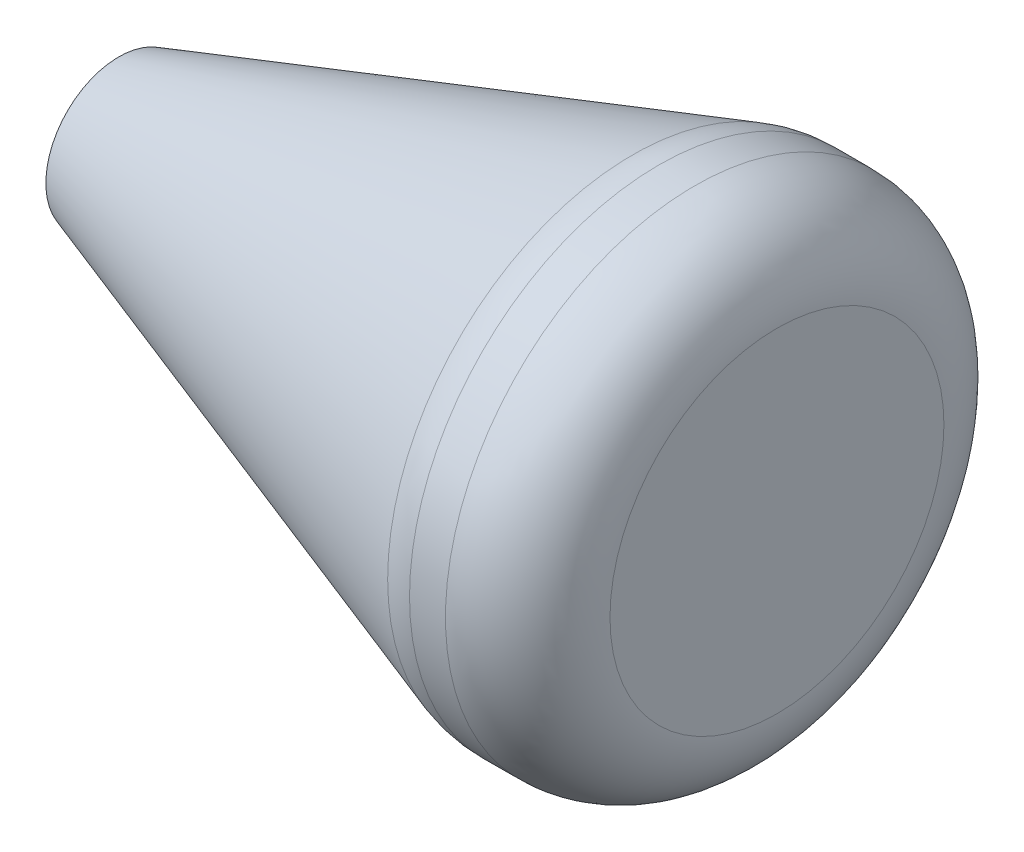
from build123d import *

# Parameters (mm, degrees)
FILLET1_R = 5
FILLET2_R = 5


with BuildPart() as part:
    # Sketch1 → Revolve1 (revolve)
    with BuildSketch(Plane(origin=(0, 0, 0), x_dir=(0, 1, 0), z_dir=(0, 0, 1)), mode=Mode.PRIVATE) as revolve1_sk:
        Polygon((0, 0), (0, 6), (2.8, 6), (2.8, 40), (4.437898451, 40), (15.149054344, 8), (15.149054344, 0), align=None)
    revolve(revolve1_sk.sketch.rotate(Axis((0, 0, 0), (-1, 0, 0)), 90), axis=Axis((0, 0, 0), (-1, 0, 0)))

    # Fillet1
    fillet1_edges = [part.edges().sort_by_distance(p)[0] for p in [
        (-8, 0, 15.149054344),
    ]]
    fillet(fillet1_edges, radius=FILLET1_R)

    # Fillet2
    fillet2_edges = [part.edges().sort_by_distance(p)[0] for p in [
        (0, 0, 15.149054344),
    ]]
    fillet(fillet2_edges, radius=FILLET2_R)


solid = part.part
